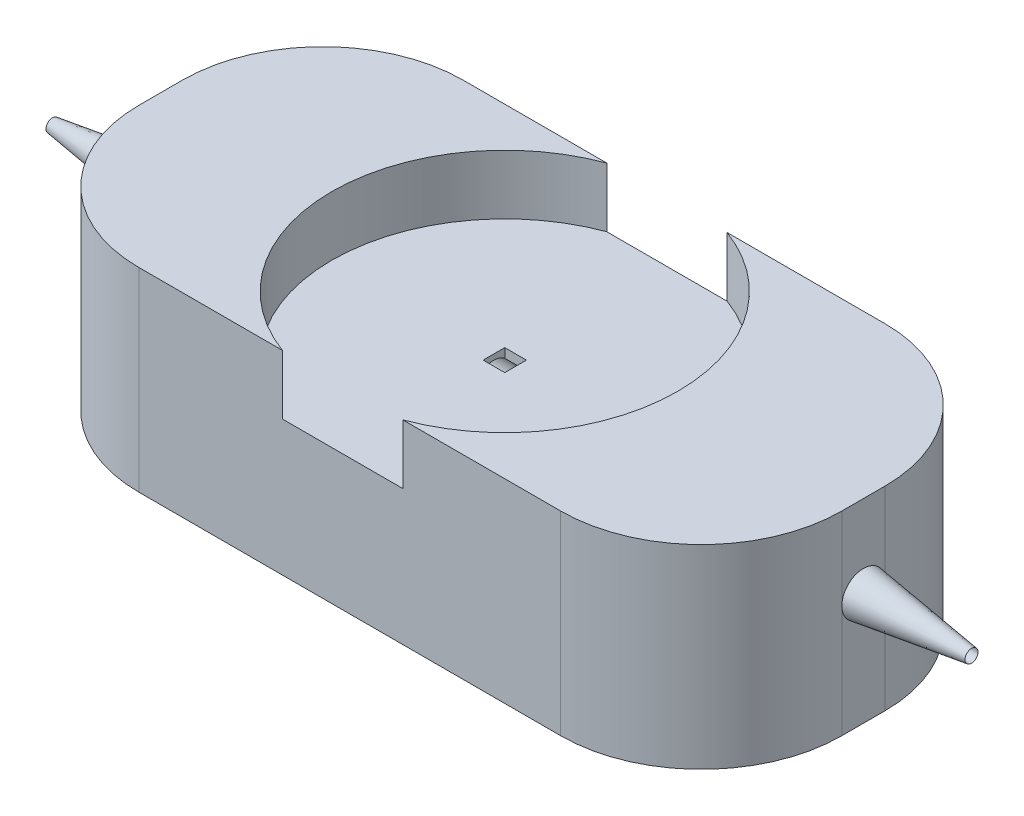
from build123d import *

# Parameters (mm, degrees)
SKETCH1_W           = 65
SKETCH1_H           = 30
BOSS_EXTRUDE1_DEPTH = 58
FILLET1_R           = 13
SKETCH15_W          = 83.696095513
SKETCH15_H          = 31.69844841
CUT_EXTRUDE7_DEPTH  = 50
SKETCH18_R          = 16
CUT_EXTRUDE10_DEPTH = 5.5
CUT_EXTRUDE12_REACH = 90.397
SKETCH3_R           = 1.6
SKETCH21_W          = 2
SKETCH21_H          = 2
CUT_EXTRUDE13_DEPTH = 8


with BuildPart() as part:
    # Sketch1 → Boss-Extrude1 (new body)
    with BuildSketch(Plane(origin=(0, 0, 0), x_dir=(1, 0, 0), z_dir=(0, 1, 0))):
        with Locations((7.5, 0)):
            Rectangle(SKETCH1_W, SKETCH1_H)
    extrude(amount=BOSS_EXTRUDE1_DEPTH)

    # Fillet1
    fillet1_edges = [part.edges().sort_by_distance(p)[0] for p in [
        (40, 29, 15),
        (-25, 29, 15),
        (-25, 29, -15),
        (40, 29, -15),
    ]]
    fillet(fillet1_edges, radius=FILLET1_R)

    # Sketch15 → Cut-Extrude7 (cut)
    with BuildSketch(Plane(origin=(0, -10, 0), x_dir=(-1, 0, 0), z_dir=(0, -1, 0))):
        with Locations((-0.057440767, 0.030479277)):
            Rectangle(SKETCH15_W, SKETCH15_H)
    extrude(amount=-CUT_EXTRUDE7_DEPTH, mode=Mode.SUBTRACT)

    # Sketch18 → Cut-Extrude10 (cut)
    with BuildSketch(Plane(origin=(0, 58, 0), x_dir=(1, 0, 0), z_dir=(0, 1, 0))):
        with Locations((6.828508286, 0)):
            Circle(SKETCH18_R)
    extrude(amount=-CUT_EXTRUDE10_DEPTH, mode=Mode.SUBTRACT)

    # Sketch3 → Cut-Extrude12 (cut, up to next)
    with BuildSketch(Plane.ZY.offset(25), mode=Mode.PRIVATE) as cut_extrude12_sk1:
        with Locations((0, 50.4)):
            Circle(SKETCH3_R)
    cut_extrude12_tool1 = extrude(cut_extrude12_sk1.sketch, amount=-CUT_EXTRUDE12_REACH, mode=Mode.PRIVATE) & part.part
    add(cut_extrude12_tool1.solids().sort_by_distance((-25, 50.4, 0))[0], mode=Mode.SUBTRACT)

    # Sketch21 → Cut-Extrude13 (cut)
    with BuildSketch(Plane(origin=(0, 52.5, 0), x_dir=(1, 0, 0), z_dir=(0, 1, 0))):
        with Locations((6.828508286, 0)):
            Rectangle(SKETCH21_W, SKETCH21_H)
    extrude(amount=-CUT_EXTRUDE13_DEPTH, mode=Mode.SUBTRACT)

    # Sketch24 → Revolve1 (revolve)
    with BuildSketch(Plane.XY, mode=Mode.PRIVATE) as revolve1_sk:
        Polygon((-25, 51), (-25, 52.4), (-35, 51), align=None)
    revolve(revolve1_sk.sketch.rotate(Axis((-25, 50.4, 0), (-1, 0, 0)), 90), axis=Axis((-25, 50.4, 0), (-1, 0, 0)))

    # Sketch25 → Revolve2 (revolve)
    with BuildSketch(Plane.XY, mode=Mode.PRIVATE) as revolve2_sk:
        Polygon((39.995235715, 52.4), (49.995235715, 51), (39.995235715, 51), align=None)
    revolve(revolve2_sk.sketch.rotate(Axis((-25, 50.4, 0), (1, 0, 0)), 90), axis=Axis((-25, 50.4, 0), (1, 0, 0)))


solid = part.part
